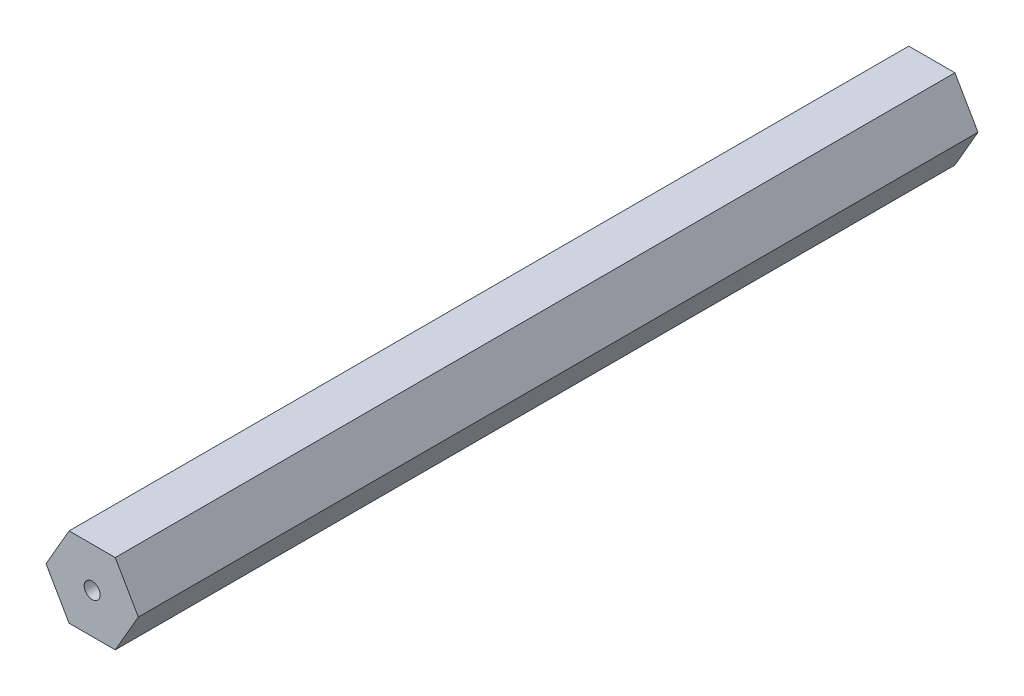
from build123d import *

# Parameters (mm, degrees)
SKETCH1_R           = 1.27
BOSS_EXTRUDE1_DEPTH = 133.35


with BuildPart() as part:
    # Sketch1 → Boss-Extrude1 (new body)
    with BuildSketch(Plane.XY):
        Polygon((7.332348419, 0), (3.666174209, 6.35), (-3.666174209, 6.35), (-7.332348419, 0), (-3.666174209, -6.35), (3.666174209, -6.35), align=None)
        Circle(SKETCH1_R, mode=Mode.SUBTRACT)
    extrude(amount=BOSS_EXTRUDE1_DEPTH)


solid = part.part
